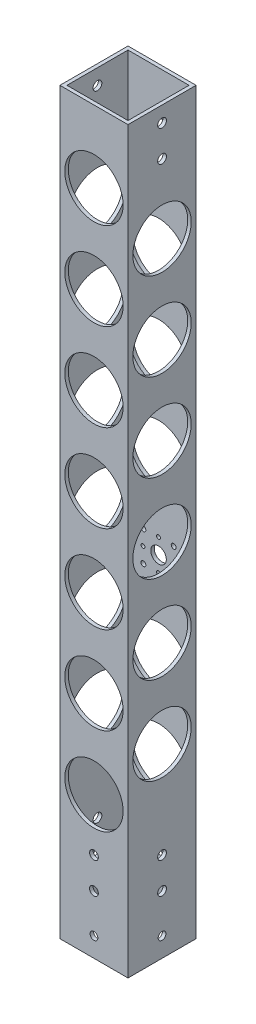
from build123d import *

# Parameters (mm, degrees)
SKETCH1_W           = 35
SKETCH1_H           = 35
SKETCH1_W_2         = 31.4
SKETCH1_H_2         = 31.4
BOSS_EXTRUDE1_DEPTH = 380
SKETCH3_R           = 2
CUT_EXTRUDE1_DEPTH  = 383.009489411
SKETCH4_R           = 2
CUT_EXTRUDE2_DEPTH  = 383.009489411
SKETCH13_R          = 15
CUT_EXTRUDE10_DEPTH = 383.009489411
SKETCH14_R          = 2.25
CUT_EXTRUDE11_DEPTH = 383.009489411
LPATTERN1_COUNT     = 6
LPATTERN1_PITCH     = 45
SKETCH16_R          = 2.25
CUT_EXTRUDE13_DEPTH = 383.009489411
SKETCH17_R          = 15
CUT_EXTRUDE14_DEPTH = 383.009489411
LPATTERN2_COUNT     = 7
LPATTERN2_PITCH     = 45
BOSS_EXTRUDE2_START = -1.8
SKETCH18_R          = 15
BOSS_EXTRUDE2_DEPTH = 1.8
SKETCH19_R          = 4
CUT_EXTRUDE15_DEPTH = 382.848778969
CUT_EXTRUDE16_REACH = 384.009
SKETCH20_R          = 1
SKETCH20_R_2        = 1.25


with BuildPart() as part:
    # Sketch1 → Boss-Extrude1 (new body)
    with BuildSketch(Plane(origin=(0, 0, 0), x_dir=(1, 0, 0), z_dir=(0, 1, 0))):
        Rectangle(SKETCH1_W, SKETCH1_H)
        Rectangle(SKETCH1_W_2, SKETCH1_H_2, mode=Mode.SUBTRACT)
    extrude(amount=BOSS_EXTRUDE1_DEPTH)

    # Sketch3 → Cut-Extrude1 (cut, through all)
    with BuildSketch(Plane.XY.offset(17.5)):
        with Locations((0, 10)):
            Circle(SKETCH3_R)
    extrude(amount=-CUT_EXTRUDE1_DEPTH, mode=Mode.SUBTRACT)

    # Sketch4 → Cut-Extrude2 (cut, through all)
    with BuildSketch(Plane(origin=(17.5, 0, 0), x_dir=(0, 0, -1), z_dir=(1, 0, 0))):
        with Locations((0, 10)):
            Circle(SKETCH4_R)
    extrude(amount=-CUT_EXTRUDE2_DEPTH, mode=Mode.SUBTRACT)

    # Sketch13 → Cut-Extrude10 (cut, through all)
    with BuildSketch(Plane.ZY.offset(17.5)):
        with Locations((0, 95.5)):
            Circle(SKETCH13_R)
    cut_extrude10 = extrude(amount=-CUT_EXTRUDE10_DEPTH, mode=Mode.SUBTRACT)

    # Sketch14 → Cut-Extrude11 (cut, through all)
    with BuildSketch(Plane(origin=(17.5, 0, 0), x_dir=(0, 0, -1), z_dir=(1, 0, 0))):
        with Locations((0, 372)):
            Circle(SKETCH14_R)
        with Locations((0, 356)):
            Circle(SKETCH14_R)
        with Locations((0, 46)):
            Circle(SKETCH14_R)
        with Locations((0, 30)):
            Circle(SKETCH14_R)
    extrude(amount=-CUT_EXTRUDE11_DEPTH, mode=Mode.SUBTRACT)

    # LPattern1: Cut-Extrude10 ×6
    with Locations(*[(0, i * LPATTERN1_PITCH, 0) for i in range(1, LPATTERN1_COUNT)]):
        add(cut_extrude10, mode=Mode.SUBTRACT)

    # Sketch16 → Cut-Extrude13 (cut, through all)
    with BuildSketch(Plane.XY.offset(17.5)):
        with Locations((0, 46)):
            Circle(SKETCH16_R)
        with Locations((0, 30)):
            Circle(SKETCH16_R)
    extrude(amount=-CUT_EXTRUDE13_DEPTH, mode=Mode.SUBTRACT)

    # Sketch17 → Cut-Extrude14 (cut, through all)
    with BuildSketch(Plane.XY.offset(17.5)):
        with Locations((0, 73)):
            Circle(SKETCH17_R)
    cut_extrude14 = extrude(amount=-CUT_EXTRUDE14_DEPTH, mode=Mode.SUBTRACT)

    # LPattern2: Cut-Extrude14 ×7
    with Locations(*[(0, i * LPATTERN2_PITCH, 0) for i in range(1, LPATTERN2_COUNT)]):
        add(cut_extrude14, mode=Mode.SUBTRACT)

    # Sketch18 → Boss-Extrude2 (add)
    with BuildSketch(Plane(origin=(0, 0, -17.5), x_dir=(-1, 0, 0), z_dir=(0, 0, -1)).offset(BOSS_EXTRUDE2_START)):
        with Locations(Location((0, 163, 0), (0, 0, 180))):
            Circle(SKETCH18_R)
    extrude(amount=BOSS_EXTRUDE2_DEPTH)

    # Sketch19 → Cut-Extrude15 (cut, through all)
    with BuildSketch(Plane.XY.offset(-15.7)):
        with Locations((0, 163)):
            Circle(SKETCH19_R)
    extrude(amount=-CUT_EXTRUDE15_DEPTH, mode=Mode.SUBTRACT)

    # Sketch20 → Cut-Extrude16 (cut, up to next)
    with BuildSketch(Plane(origin=(0, 0, -17.5), x_dir=(-1, 0, 0), z_dir=(0, 0, -1)), mode=Mode.PRIVATE) as cut_extrude16_sk1:
        with Locations((0, 171)):
            Circle(SKETCH20_R)
    cut_extrude16_tool1 = extrude(cut_extrude16_sk1.sketch, amount=-CUT_EXTRUDE16_REACH, mode=Mode.PRIVATE) & part.part
    # Sketch20 → Cut-Extrude16 (cut, up to next)
    with BuildSketch(Plane(origin=(0, 0, -17.5), x_dir=(-1, 0, 0), z_dir=(0, 0, -1)), mode=Mode.PRIVATE) as cut_extrude16_sk2:
        with Locations((0, 155)):
            Circle(SKETCH20_R)
    cut_extrude16_tool2 = extrude(cut_extrude16_sk2.sketch, amount=-CUT_EXTRUDE16_REACH, mode=Mode.PRIVATE) & part.part
    # Sketch20 → Cut-Extrude16 (cut, up to next)
    with BuildSketch(Plane(origin=(0, 0, -17.5), x_dir=(-1, 0, 0), z_dir=(0, 0, -1)), mode=Mode.PRIVATE) as cut_extrude16_sk3:
        with Locations((8, 163)):
            Circle(SKETCH20_R)
    cut_extrude16_tool3 = extrude(cut_extrude16_sk3.sketch, amount=-CUT_EXTRUDE16_REACH, mode=Mode.PRIVATE) & part.part
    # Sketch20 → Cut-Extrude16 (cut, up to next)
    with BuildSketch(Plane(origin=(0, 0, -17.5), x_dir=(-1, 0, 0), z_dir=(0, 0, -1)), mode=Mode.PRIVATE) as cut_extrude16_sk4:
        with Locations((-8, 163)):
            Circle(SKETCH20_R)
    cut_extrude16_tool4 = extrude(cut_extrude16_sk4.sketch, amount=-CUT_EXTRUDE16_REACH, mode=Mode.PRIVATE) & part.part
    # Sketch20 → Cut-Extrude16 (cut, up to next)
    with BuildSketch(Plane(origin=(0, 0, -17.5), x_dir=(-1, 0, 0), z_dir=(0, 0, -1)), mode=Mode.PRIVATE) as cut_extrude16_sk5:
        with Locations((-7.778174593, 155.221825407)):
            Circle(SKETCH20_R_2)
    cut_extrude16_tool5 = extrude(cut_extrude16_sk5.sketch, amount=-CUT_EXTRUDE16_REACH, mode=Mode.PRIVATE) & part.part
    # Sketch20 → Cut-Extrude16 (cut, up to next)
    with BuildSketch(Plane(origin=(0, 0, -17.5), x_dir=(-1, 0, 0), z_dir=(0, 0, -1)), mode=Mode.PRIVATE) as cut_extrude16_sk6:
        with Locations((7.778174593, 155.221825407)):
            Circle(SKETCH20_R_2)
    cut_extrude16_tool6 = extrude(cut_extrude16_sk6.sketch, amount=-CUT_EXTRUDE16_REACH, mode=Mode.PRIVATE) & part.part
    # Sketch20 → Cut-Extrude16 (cut, up to next)
    with BuildSketch(Plane(origin=(0, 0, -17.5), x_dir=(-1, 0, 0), z_dir=(0, 0, -1)), mode=Mode.PRIVATE) as cut_extrude16_sk7:
        with Locations((7.778174593, 170.778174593)):
            Circle(SKETCH20_R_2)
    cut_extrude16_tool7 = extrude(cut_extrude16_sk7.sketch, amount=-CUT_EXTRUDE16_REACH, mode=Mode.PRIVATE) & part.part
    # Sketch20 → Cut-Extrude16 (cut, up to next)
    with BuildSketch(Plane(origin=(0, 0, -17.5), x_dir=(-1, 0, 0), z_dir=(0, 0, -1)), mode=Mode.PRIVATE) as cut_extrude16_sk8:
        with Locations((-7.778174593, 170.778174593)):
            Circle(SKETCH20_R_2)
    cut_extrude16_tool8 = extrude(cut_extrude16_sk8.sketch, amount=-CUT_EXTRUDE16_REACH, mode=Mode.PRIVATE) & part.part
    add(cut_extrude16_tool1.solids().sort_by_distance((0, 171, -17.5))[0], mode=Mode.SUBTRACT)
    add(cut_extrude16_tool2.solids().sort_by_distance((0, 155, -17.5))[0], mode=Mode.SUBTRACT)
    add(cut_extrude16_tool3.solids().sort_by_distance((-8, 163, -17.5))[0], mode=Mode.SUBTRACT)
    add(cut_extrude16_tool4.solids().sort_by_distance((8, 163, -17.5))[0], mode=Mode.SUBTRACT)
    add(cut_extrude16_tool5.solids().sort_by_distance((7.778175, 155.221825, -17.5))[0], mode=Mode.SUBTRACT)
    add(cut_extrude16_tool6.solids().sort_by_distance((-7.778175, 155.221825, -17.5))[0], mode=Mode.SUBTRACT)
    add(cut_extrude16_tool7.solids().sort_by_distance((-7.778175, 170.778175, -17.5))[0], mode=Mode.SUBTRACT)
    add(cut_extrude16_tool8.solids().sort_by_distance((7.778175, 170.778175, -17.5))[0], mode=Mode.SUBTRACT)


solid = part.part
